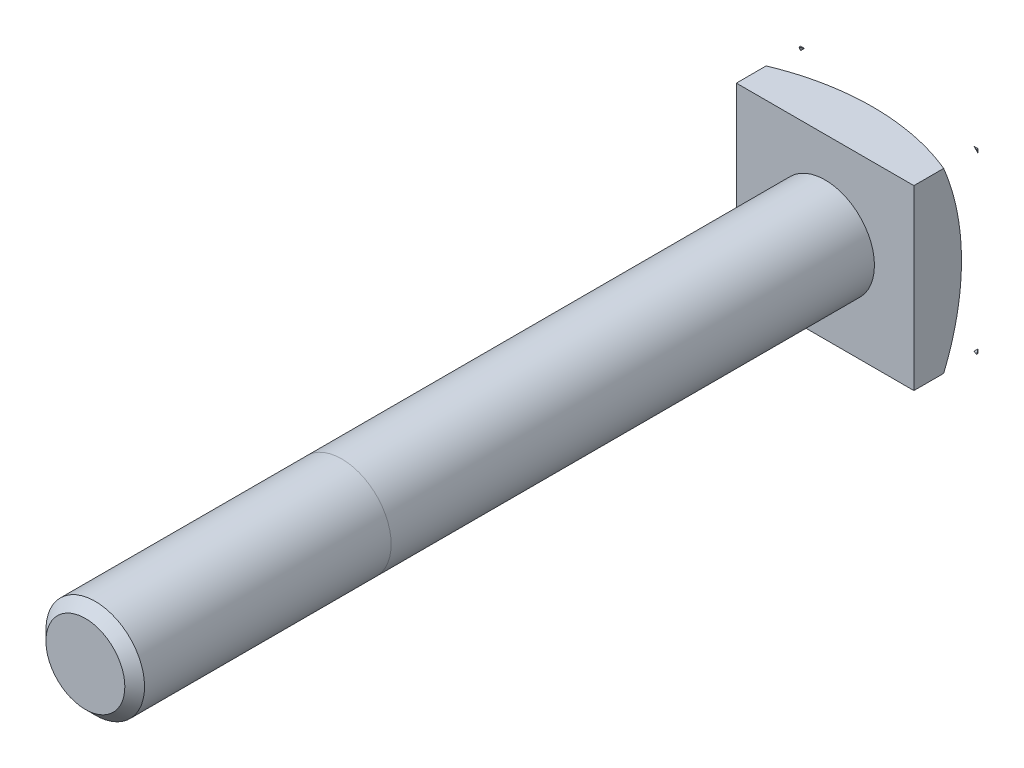
from build123d import *

# Parameters (mm, degrees)
SKETCH1_W           = 18
SKETCH1_H           = 18
BOSS_EXTRUDE1_DEPTH = 3.25
SKETCH2_R           = 5
BOSS_EXTRUDE3_DEPTH = 75
CHAMFER1_SIZE       = 1


with BuildPart() as part:
    # Sketch1 → Boss-Extrude1 (new, symmetric)
    with BuildSketch(Plane.XY):
        Rectangle(SKETCH1_W, SKETCH1_H)
    extrude(amount=BOSS_EXTRUDE1_DEPTH, both=True)

    # Sketch2 → Boss-Extrude3 (add)
    with BuildSketch(Plane.XY.offset(3.25)):
        Circle(SKETCH2_R)
    extrude(amount=BOSS_EXTRUDE3_DEPTH)

    # Sketch3 → Cut-Revolve1 (revolve, cut)
    with BuildSketch(Plane(origin=(0, 0, 0), x_dir=(1, 0, 0), z_dir=(0, 1, 0))):
        with BuildLine():
            Line((0, 3.25), (0, 6.172726033))
            ThreePointArc((0, 6.172726033), (19.744348927, -2.005651073), (27.922726033, -21.75))
            Line((27.922726033, -21.75), (25, -21.75))
            ThreePointArc((25, -21.75), (17.67766953, -4.07233047), (0, 3.25))
        make_face()
    revolve(axis=Axis((0, 0, 21.75), (0, 0, -1)), mode=Mode.SUBTRACT)


with BuildPart() as cut_revolve1_piece_1:
    # of the separate pieces the step leaves, piece 1, a body of its own (cut_revolve1_pieces)
    add(part.part.solids().sort_by_distance((-9, 9, 0.232565209))[0])

    # Chamfer1
    chamfer1_edges = [cut_revolve1_piece_1.edges().sort_by_distance(p)[0] for p in [
        (-5, 0, 78.25),
    ]]
    chamfer(chamfer1_edges, length=CHAMFER1_SIZE)


with BuildPart() as cut_revolve1_piece_2:
    # of the separate pieces the step leaves, piece 2, a body of its own (cut_revolve1_pieces)
    add(part.part.solids().sort_by_distance((-9, -9, -3.25))[0])


with BuildPart() as cut_revolve1_piece_3:
    # of the separate pieces the step leaves, piece 3, a body of its own (cut_revolve1_pieces)
    add(part.part.solids().sort_by_distance((-9, 9, -3.25))[0])


with BuildPart() as cut_revolve1_piece_4:
    # of the separate pieces the step leaves, piece 4, a body of its own (cut_revolve1_pieces)
    add(part.part.solids().sort_by_distance((8.58362564, 9, -3.25))[0])


with BuildPart() as cut_revolve1_piece_5:
    # of the separate pieces the step leaves, piece 5, a body of its own (cut_revolve1_pieces)
    add(part.part.solids().sort_by_distance((9, -8.58362564, -3.25))[0])


solid = Compound([cut_revolve1_piece_1.part, cut_revolve1_piece_2.part, cut_revolve1_piece_3.part, cut_revolve1_piece_4.part, cut_revolve1_piece_5.part])
